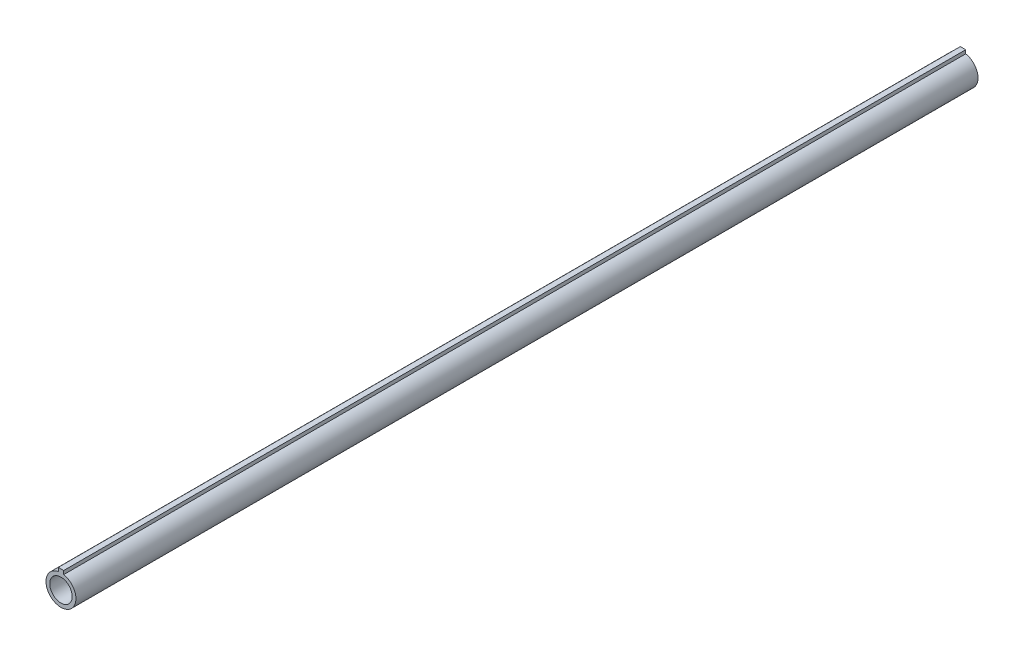
from build123d import *

# Parameters (mm, degrees)
SALIENTE_EXTRUIR1_DEPTH = 150.6
CROQUIS2_R              = 1.875
CORTAR_EXTRUIR1_DEPTH   = 72
CORTAR_EXTRUIR2_START   = -72
CROQUIS3_R              = 1.875
CORTAR_EXTRUIR2_DEPTH   = 72


with BuildPart() as part:
    # Croquis1 → Saliente-Extruir1 (new body)
    with BuildSketch(Plane.XY):
        with BuildLine():
            Line((-78.077598734, 121.298692457), (-78.077598734, 121.898692457))
            Line((-78.077598734, 121.898692457), (-77.177598734, 121.898692457))
            Line((-77.177598734, 121.898692457), (-77.177598734, 121.298692457))
            ThreePointArc((-77.177598734, 121.298692457), (-77.627598734, 116.339525931), (-78.077598734, 121.298692457))
        make_face()
    extrude(amount=SALIENTE_EXTRUIR1_DEPTH)

    # Croquis2 → Cortar-Extruir1 (cut)
    with BuildSketch(Plane.XY.offset(150.6)):
        with Locations((-77.627598734, 118.839525931)):
            Circle(CROQUIS2_R)
    extrude(amount=-CORTAR_EXTRUIR1_DEPTH, mode=Mode.SUBTRACT)

    # Croquis3 → Cortar-Extruir2 (cut)
    with BuildSketch(Plane(origin=(0, 0, 0), x_dir=(-1, 0, 0), z_dir=(0, 0, -1)).offset(CORTAR_EXTRUIR2_START)):
        with Locations(Location((77.627598734, 118.839525931, 0), (0, 0, 180))):
            Circle(CROQUIS3_R)
    extrude(amount=CORTAR_EXTRUIR2_DEPTH, mode=Mode.SUBTRACT)


solid = part.part
